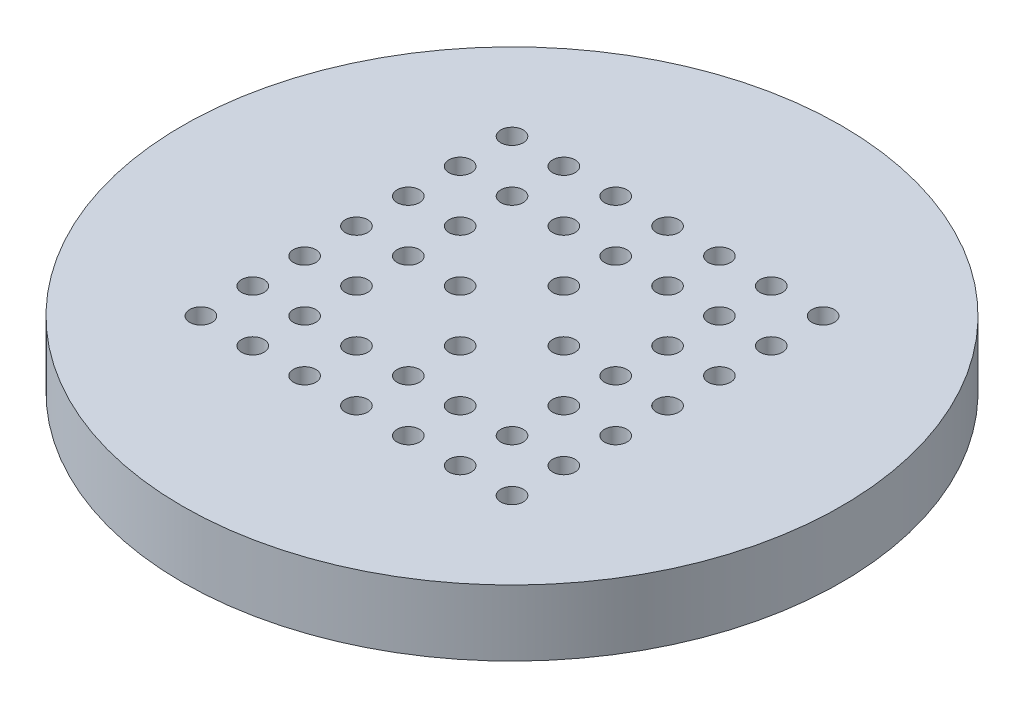
from build123d import *

# Parameters (mm, degrees)
SKETCH1_R                                 = 19.05
BILLET_DEPTH                              = 3.81
SKETCH2_R                                 = 0.6477
FIRST_LOX_HOLE_DEPTH                      = 28.208842313
BRAISING_CHAMFER_SIZE                     = 0.254
LOX_HOLE_PATTERN_COUNT                    = 7
LOX_HOLE_PATTERN_PITCH                    = 2.9972
LOX_HOLE_PATTERN_COUNT_DIR2               = 7
LOX_HOLE_PATTERN_PITCH_DIR2               = 2.9972
BRAISING_CHAMFER_OF_LOX_HOLE_PATTERN_SIZE = 0.254
SKETCH3_R                                 = 0.79375
DOWEL_HOLE_DEPTH                          = 1.5875


with BuildPart() as part:
    # Sketch1 → Billet (new body)
    with BuildSketch(Plane(origin=(0, 0, 0), x_dir=(1, 0, 0), z_dir=(0, 1, 0))):
        Circle(SKETCH1_R)
    extrude(amount=-BILLET_DEPTH)

    # Sketch2 → First Lox Hole (cut, symmetric)
    with BuildSketch(Plane(origin=(0, 0, 0), x_dir=(1, 0, 0), z_dir=(0, 1, 0))):
        with Locations((8.9916, 8.9916)):
            Circle(SKETCH2_R)
    first_lox_hole = extrude(amount=FIRST_LOX_HOLE_DEPTH, both=True, mode=Mode.SUBTRACT)

    # Braising Chamfer
    braising_chamfer_edges = [part.edges().sort_by_distance(p)[0] for p in [
        (8.3439, -3.81, -8.9916),
    ]]
    chamfer(braising_chamfer_edges, length=BRAISING_CHAMFER_SIZE)

    # Lox Hole Pattern: First Lox Hole 7 × 7, 5 skipped
    with Locations(*[(-i * LOX_HOLE_PATTERN_PITCH, 0, j * LOX_HOLE_PATTERN_PITCH_DIR2) for i in range(LOX_HOLE_PATTERN_COUNT) for j in range(LOX_HOLE_PATTERN_COUNT_DIR2) if (i, j) not in ((0, 0), (2, 2), (2, 4), (3, 3), (4, 2), (4, 4))]):
        add(first_lox_hole, mode=Mode.SUBTRACT)

    # Braising Chamfer of Lox Hole Pattern
    braising_chamfer_of_lox_hole_pattern_edges = [part.edges().sort_by_distance(p)[0] for p in [
        (8.3439, -3.81, -5.9944),
        (8.3439, -3.81, -2.9972),
        (8.3439, -3.81, 0),
        (8.3439, -3.81, 2.9972),
        (8.3439, -3.81, 5.9944),
        (8.3439, -3.81, 8.9916),
        (5.3467, -3.81, -8.9916),
        (5.3467, -3.81, -5.9944),
        (5.3467, -3.81, -2.9972),
        (5.3467, -3.81, 0),
        (5.3467, -3.81, 2.9972),
        (5.3467, -3.81, 5.9944),
        (5.3467, -3.81, 8.9916),
        (2.3495, -3.81, -8.9916),
        (2.3495, -3.81, -5.9944),
        (2.3495, -3.81, 0),
        (2.3495, -3.81, 5.9944),
        (2.3495, -3.81, 8.9916),
        (-0.6477, -3.81, -8.9916),
        (-0.6477, -3.81, -5.9944),
        (-0.6477, -3.81, -2.9972),
        (-0.6477, -3.81, 2.9972),
        (-0.6477, -3.81, 5.9944),
        (-0.6477, -3.81, 8.9916),
        (-3.6449, -3.81, -8.9916),
        (-3.6449, -3.81, -5.9944),
        (-3.6449, -3.81, 0),
        (-3.6449, -3.81, 5.9944),
        (-3.6449, -3.81, 8.9916),
        (-6.6421, -3.81, -8.9916),
        (-6.6421, -3.81, -5.9944),
        (-6.6421, -3.81, -2.9972),
        (-6.6421, -3.81, 0),
        (-6.6421, -3.81, 2.9972),
        (-6.6421, -3.81, 5.9944),
        (-6.6421, -3.81, 8.9916),
        (-9.6393, -3.81, -8.9916),
        (-9.6393, -3.81, -5.9944),
        (-9.6393, -3.81, -2.9972),
        (-9.6393, -3.81, 0),
        (-9.6393, -3.81, 2.9972),
        (-9.6393, -3.81, 5.9944),
        (-9.6393, -3.81, 8.9916),
    ]]
    chamfer(braising_chamfer_of_lox_hole_pattern_edges, length=BRAISING_CHAMFER_OF_LOX_HOLE_PATTERN_SIZE)

    # Sketch3 → Dowel Hole (cut)
    with BuildSketch(Plane(origin=(0, -3.81, 0), x_dir=(-1, 0, 0), z_dir=(0, 1, 0))):
        with Locations((0, 15.24)):
            Circle(SKETCH3_R)
        with Locations((0, -15.24)):
            Circle(SKETCH3_R)
    extrude(amount=DOWEL_HOLE_DEPTH, mode=Mode.SUBTRACT)


solid = part.part
